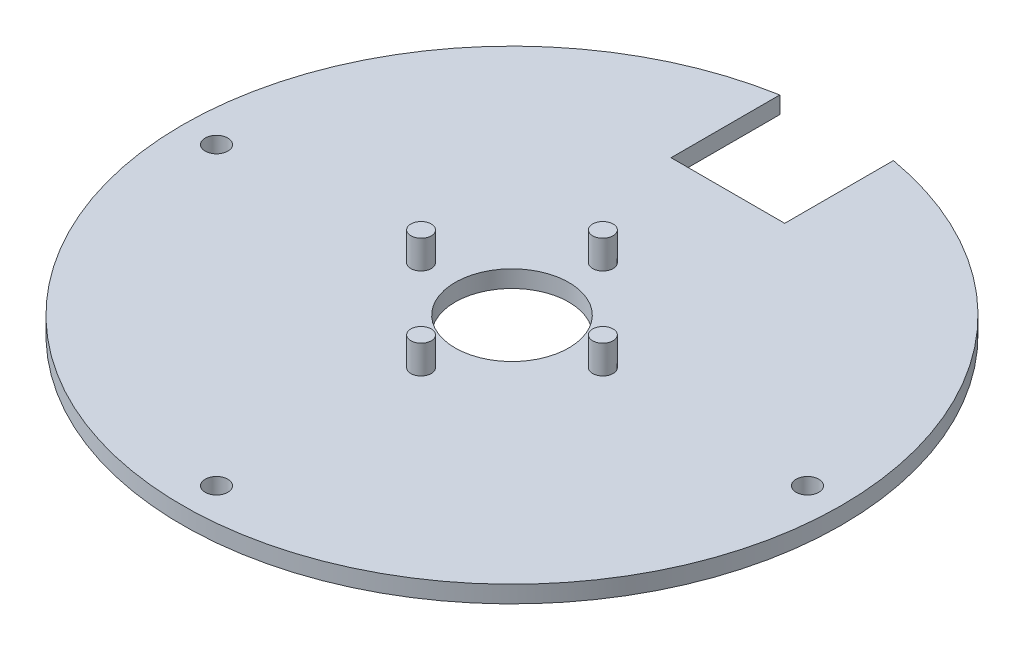
from build123d import *

# Parameters (mm, degrees)
SKETCH1_R           = 29
BOSS_EXTRUDE1_DEPTH = 5
SKETCH4_R           = 0.9
BOSS_EXTRUDE2_DEPTH = 2.5
SKETCH7_R           = 5
CUT_EXTRUDE4_DEPTH  = 5
SKETCH11_R          = 1
CUT_EXTRUDE6_DEPTH  = 5
SKETCH12_R          = 29
CUT_EXTRUDE7_DEPTH  = 1
SKETCH13_W          = 10
SKETCH13_H          = 10
CUT_EXTRUDE8_DEPTH  = 10
SKETCH14_R          = 29
CUT_EXTRUDE9_DEPTH  = 2.5


with BuildPart() as part:
    # Sketch1 → Boss-Extrude1 (new body)
    with BuildSketch(Plane(origin=(0, 0, 0), x_dir=(1, 0, 0), z_dir=(0, 1, 0))):
        with Locations(Location((0, 0, 0), (0, 0, 270))):
            Circle(SKETCH1_R)
    extrude(amount=BOSS_EXTRUDE1_DEPTH)

    # Sketch4 → Boss-Extrude2 (add)
    with BuildSketch(Plane(origin=(0, 5, 0), x_dir=(1, 0, 0), z_dir=(0, 1, 0))):
        with Locations(Location((8, 0, 0), (0, 0, 270))):
            Circle(SKETCH4_R)
        with Locations(Location((-8, 0, 0), (0, 0, 270))):
            Circle(SKETCH4_R)
        with Locations(Location((0, 8, 0), (0, 0, 270))):
            Circle(SKETCH4_R)
        with Locations(Location((0, -8, 0), (0, 0, 270))):
            Circle(SKETCH4_R)
    extrude(amount=BOSS_EXTRUDE2_DEPTH)

    # Sketch7 → Cut-Extrude4 (cut)
    with BuildSketch(Plane(origin=(0, 5, 0), x_dir=(1, 0, 0), z_dir=(0, 1, 0))):
        with Locations(Location((0, 0, 0), (0, 0, 270))):
            Circle(SKETCH7_R)
    extrude(amount=-CUT_EXTRUDE4_DEPTH, mode=Mode.SUBTRACT)

    # Sketch11 → Cut-Extrude6 (cut)
    with BuildSketch(Plane(origin=(0, 5, 0), x_dir=(1, 0, 0), z_dir=(0, 1, 0))):
        with Locations(Location((-26, 0, 0), (0, 0, 270))):
            Circle(SKETCH11_R)
        with Locations(Location((0, -26, 0), (0, 0, 270))):
            Circle(SKETCH11_R)
        with Locations(Location((26, 0, 0), (0, 0, 270))):
            Circle(SKETCH11_R)
    extrude(amount=-CUT_EXTRUDE6_DEPTH, mode=Mode.SUBTRACT)

    # Sketch12 → Cut-Extrude7 (cut)
    with BuildSketch(Plane(origin=(0, 0, 0), x_dir=(-1, 0, 0), z_dir=(0, -1, 0))):
        with Locations(Location((0, 0, 0), (0, 0, 90))):
            Circle(SKETCH12_R)
    extrude(amount=-CUT_EXTRUDE7_DEPTH, mode=Mode.SUBTRACT)

    # Sketch13 → Cut-Extrude8 (cut)
    with BuildSketch(Plane(origin=(0, 5, 0), x_dir=(1, 0, 0), z_dir=(0, 1, 0))):
        with Locations((0, 24)):
            Rectangle(SKETCH13_W, SKETCH13_H)
    extrude(amount=-CUT_EXTRUDE8_DEPTH, mode=Mode.SUBTRACT)

    # Sketch14 → Cut-Extrude9 (cut)
    with BuildSketch(Plane(origin=(0, 1, 0), x_dir=(-1, 0, 0), z_dir=(0, -1, 0))):
        Circle(SKETCH14_R)
    extrude(amount=-CUT_EXTRUDE9_DEPTH, mode=Mode.SUBTRACT)


solid = part.part
